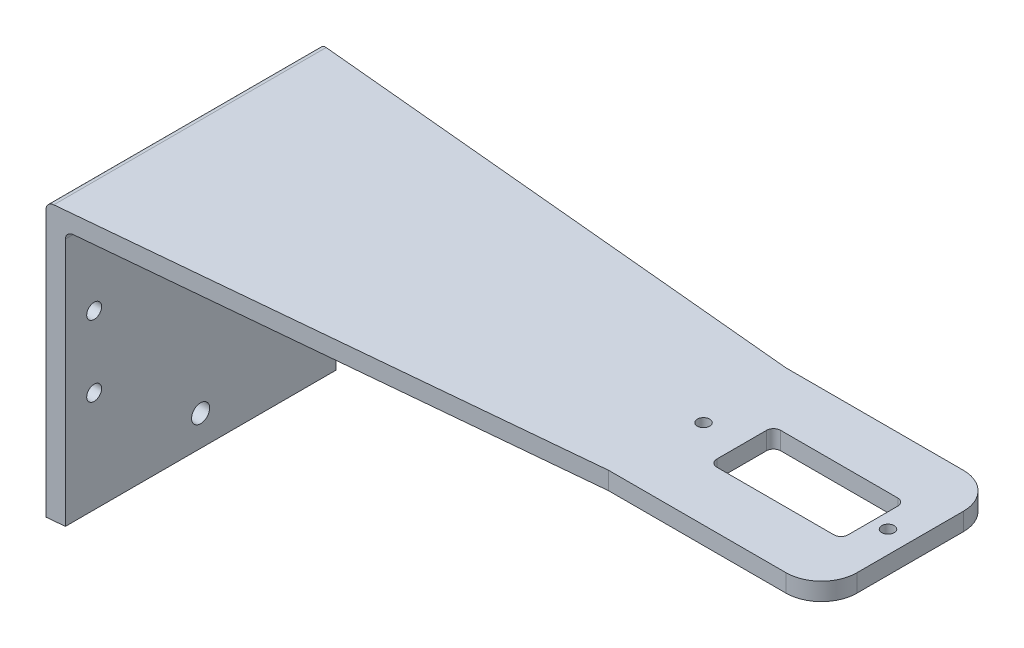
from build123d import *

# Parameters (mm, degrees)
BOSS_EXTRUDE1_DEPTH = 77.15
CUT_EXTRUDE1_REACH  = 208.975
SKETCH2_R           = 1.75
SKETCH2_W           = 37
SKETCH2_H           = 18
FILLET1_R           = 2
FILLET2_R           = 10
SKETCH6_OUTSIDE_W   = 125.596
SKETCH6_OUTSIDE_H   = 125.596
SKETCH6_OUTSIDE_W_2 = 77.15
SKETCH6_OUTSIDE_H_2 = 77.15
SKETCH6_OUTSIDE_R   = 2.1
SKETCH6_OUTSIDE_R_2 = 2.55
CUT_EXTRUDE2_DEPTH  = 5


with BuildPart() as part:
    # Sketch1 → Boss-Extrude1 (new body)
    with BuildSketch(Plane.XY):
        Polygon((-29.117903226, 28.371290323), (-29.117903226, -48.778709677), (-24.117903226, -48.778709677), (-24.117903226, 23.371290323), (175.882096774, 23.371290323), (175.882096774, 28.371290323), align=None)
    extrude(amount=BOSS_EXTRUDE1_DEPTH)

    # Sketch2 → Cut-Extrude1 (cut, up to next)
    with BuildSketch(Plane(origin=(0, 28.371290323, 0), x_dir=(1, 0, 0), z_dir=(0, 1, 0)), mode=Mode.PRIVATE) as cut_extrude1_sk1:
        with Locations(Location((169.632096774, -38.575, 0), (0, 0, 180))):
            Circle(SKETCH2_R)
    cut_extrude1_tool1 = extrude(cut_extrude1_sk1.sketch, amount=-CUT_EXTRUDE1_REACH, mode=Mode.PRIVATE) & part.part
    # Sketch2 → Cut-Extrude1 (cut, up to next)
    with BuildSketch(Plane(origin=(0, 28.371290323, 0), x_dir=(1, 0, 0), z_dir=(0, 1, 0)), mode=Mode.PRIVATE) as cut_extrude1_sk2:
        with Locations(Location((117.632096774, -38.575, 0), (0, 0, 180))):
            Circle(SKETCH2_R)
    cut_extrude1_tool2 = extrude(cut_extrude1_sk2.sketch, amount=-CUT_EXTRUDE1_REACH, mode=Mode.PRIVATE) & part.part
    # Sketch2 → Cut-Extrude1 (cut, up to next)
    with BuildSketch(Plane(origin=(0, 28.371290323, 0), x_dir=(1, 0, 0), z_dir=(0, 1, 0)), mode=Mode.PRIVATE) as cut_extrude1_sk3:
        Polygon((175.882096774, -13.575), (115.882096774, -13.575), (-29.117903226, 0), (175.882096774, 0), align=None)
    cut_extrude1_tool3 = extrude(cut_extrude1_sk3.sketch, amount=-CUT_EXTRUDE1_REACH, mode=Mode.PRIVATE) & part.part
    # Sketch2 → Cut-Extrude1 (cut, up to next)
    with BuildSketch(Plane(origin=(0, 28.371290323, 0), x_dir=(1, 0, 0), z_dir=(0, 1, 0)), mode=Mode.PRIVATE) as cut_extrude1_sk4:
        Polygon((175.882096774, -63.575), (115.882096774, -63.575), (-29.117903226, -77.15), (175.882096774, -77.15), align=None)
    cut_extrude1_tool4 = extrude(cut_extrude1_sk4.sketch, amount=-CUT_EXTRUDE1_REACH, mode=Mode.PRIVATE) & part.part
    # Sketch2 → Cut-Extrude1 (cut, up to next)
    with BuildSketch(Plane(origin=(0, 28.371290323, 0), x_dir=(1, 0, 0), z_dir=(0, 1, 0)), mode=Mode.PRIVATE) as cut_extrude1_sk5:
        with Locations((146.882096774, -38.575)):
            Rectangle(SKETCH2_W, SKETCH2_H)
    cut_extrude1_tool5 = extrude(cut_extrude1_sk5.sketch, amount=-CUT_EXTRUDE1_REACH, mode=Mode.PRIVATE) & part.part
    add(cut_extrude1_tool1.solids().sort_by_distance((169.632097, 28.37129, 38.575))[0], mode=Mode.SUBTRACT)
    add(cut_extrude1_tool2.solids().sort_by_distance((117.632097, 28.37129, 38.575))[0], mode=Mode.SUBTRACT)
    add(cut_extrude1_tool3.solids().sort_by_distance((103.020462, 28.37129, 5.549528))[0], mode=Mode.SUBTRACT)
    add(cut_extrude1_tool4.solids().sort_by_distance((103.020462, 28.37129, 71.600472))[0], mode=Mode.SUBTRACT)
    add(cut_extrude1_tool5.solids().sort_by_distance((146.882097, 28.37129, 38.575))[0], mode=Mode.SUBTRACT)

    # Fillet1
    fillet1_edges = [part.edges().sort_by_distance(p)[0] for p in [
        (-29.117903226, 28.371290323, 38.575),
        (-24.117903226, 23.371290323, 38.575),
        (128.382096774, 25.871290323, 47.575),
        (128.382096774, 25.871290323, 29.575),
        (165.382096774, 25.871290323, 29.575),
        (165.382096774, 25.871290323, 47.575),
    ]]
    fillet(fillet1_edges, radius=FILLET1_R)

    # Fillet2
    fillet2_edges = [part.edges().sort_by_distance(p)[0] for p in [
        (175.882096774, 25.871290323, 13.575),
        (175.882096774, 25.871290323, 63.575),
    ]]
    fillet(fillet2_edges, radius=FILLET2_R)

    # Sketch6 outside → Cut-Extrude2 (cut)
    # profile 1 of 6: a face of its own
    with BuildSketch(Plane.ZY.offset(29.117903226)):
        with Locations((38.575, -10.204)):
            Rectangle(SKETCH6_OUTSIDE_W, SKETCH6_OUTSIDE_H)
        with Locations((38.575, -10.203709677)):
            Rectangle(SKETCH6_OUTSIDE_W_2, SKETCH6_OUTSIDE_H_2, mode=Mode.SUBTRACT)
    # profile 2 of 6: a face of its own
    with BuildSketch(Plane.ZY.offset(29.117903226)):
        with Locations((8.575, -20.203709677)):
            Circle(SKETCH6_OUTSIDE_R)
    # profile 3 of 6: a face of its own
    with BuildSketch(Plane.ZY.offset(29.117903226)):
        with Locations((8.575, -0.203709677)):
            Circle(SKETCH6_OUTSIDE_R)
    # profile 4 of 6: a face of its own
    with BuildSketch(Plane.ZY.offset(29.117903226)):
        with Locations((38.575, -40.203709677)):
            Circle(SKETCH6_OUTSIDE_R_2)
    # profile 5 of 6: a face of its own
    with BuildSketch(Plane.ZY.offset(29.117903226)):
        with Locations((68.575, -20.203709677)):
            Circle(SKETCH6_OUTSIDE_R)
    # profile 6 of 6: a face of its own
    with BuildSketch(Plane.ZY.offset(29.117903226)):
        with Locations((68.575, -0.203709677)):
            Circle(SKETCH6_OUTSIDE_R)
    extrude(amount=-CUT_EXTRUDE2_DEPTH, mode=Mode.SUBTRACT)


solid = part.part
